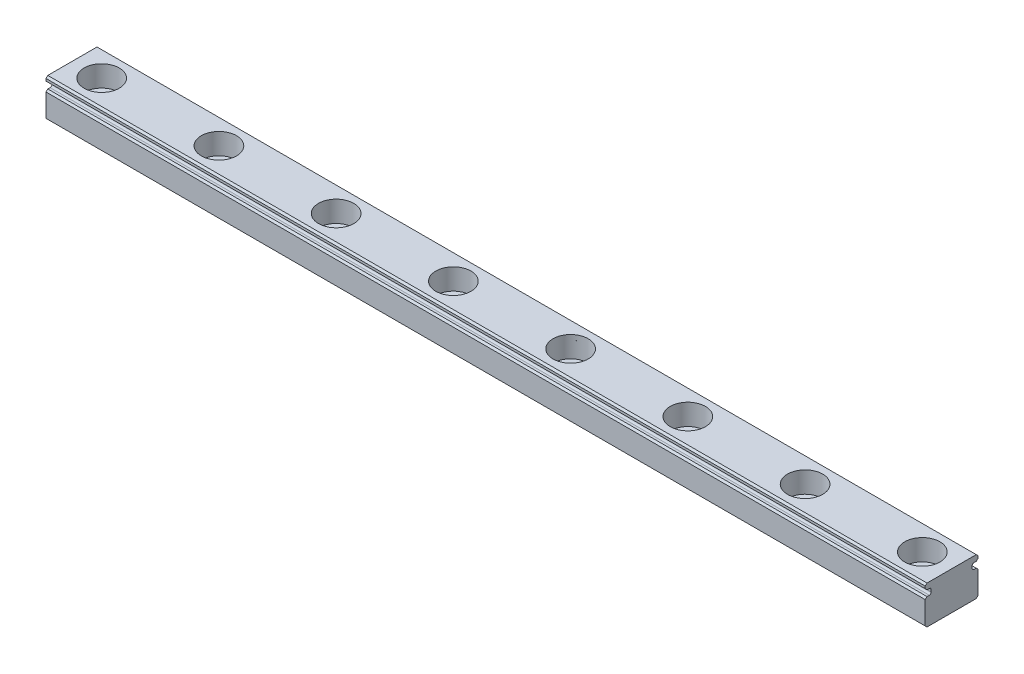
from build123d import *

# Parameters (mm, degrees)
SKETCH1_W           = 150
SKETCH1_H           = 9
BOSS_EXTRUDE1_DEPTH = 6.5
SKETCH2_W           = 1
SKETCH2_H           = 1
CUT_EXTRUDE1_DEPTH  = 156.5
SKETCH3_R           = 1.8
CUT_EXTRUDE2_DEPTH  = 9.5
SKETCH4_R           = 3
CUT_EXTRUDE3_DEPTH  = 3.6
FILLET1_R           = 0.3
CHAMFER1_SIZE       = 0.3


with BuildPart() as part:
    # Sketch1 → Boss-Extrude1 (new body)
    with BuildSketch(Plane(origin=(0, 0, 0), x_dir=(1, 0, 0), z_dir=(0, 1, 0))):
        with Locations((75, 4.5)):
            Rectangle(SKETCH1_W, SKETCH1_H)
    extrude(amount=BOSS_EXTRUDE1_DEPTH)

    # Sketch2 → Cut-Extrude1 (cut)
    with BuildSketch(Plane(origin=(150, 0, 0), x_dir=(0, 0, -1), z_dir=(1, 0, 0))):
        with Locations((0.5, 5)):
            Rectangle(SKETCH2_W, SKETCH2_H)
        with Locations((8.5, 5)):
            Rectangle(SKETCH2_W, SKETCH2_H)
    extrude(amount=-CUT_EXTRUDE1_DEPTH, mode=Mode.SUBTRACT)

    # Sketch3 → Cut-Extrude2 (cut)
    with BuildSketch(Plane(origin=(0, 6.5, 0), x_dir=(1, 0, 0), z_dir=(0, 1, 0))):
        with Locations(Location((5, 4.5, 0), (0, 0, 270))):
            Circle(SKETCH3_R)
        with Locations(Location((25, 4.5, 0), (0, 0, 270))):
            Circle(SKETCH3_R)
        with Locations(Location((45, 4.5, 0), (0, 0, 270))):
            Circle(SKETCH3_R)
        with Locations(Location((65, 4.5, 0), (0, 0, 270))):
            Circle(SKETCH3_R)
        with Locations(Location((85, 4.5, 0), (0, 0, 270))):
            Circle(SKETCH3_R)
        with Locations(Location((105, 4.5, 0), (0, 0, 270))):
            Circle(SKETCH3_R)
        with Locations(Location((125, 4.5, 0), (0, 0, 270))):
            Circle(SKETCH3_R)
        with Locations(Location((145, 4.5, 0), (0, 0, 270))):
            Circle(SKETCH3_R)
    extrude(amount=-CUT_EXTRUDE2_DEPTH, mode=Mode.SUBTRACT)

    # Sketch4 → Cut-Extrude3 (cut)
    with BuildSketch(Plane(origin=(0, 6.5, 0), x_dir=(1, 0, 0), z_dir=(0, 1, 0))):
        with Locations(Location((5, 4.5, 0), (0, 0, 270))):
            Circle(SKETCH4_R)
        with Locations(Location((25, 4.5, 0), (0, 0, 270))):
            Circle(SKETCH4_R)
        with Locations(Location((45, 4.5, 0), (0, 0, 270))):
            Circle(SKETCH4_R)
        with Locations(Location((65, 4.5, 0), (0, 0, 270))):
            Circle(SKETCH4_R)
        with Locations(Location((85, 4.5, 0), (0, 0, 270))):
            Circle(SKETCH4_R)
        with Locations(Location((105, 4.5, 0), (0, 0, 270))):
            Circle(SKETCH4_R)
        with Locations(Location((125, 4.5, 0), (0, 0, 270))):
            Circle(SKETCH4_R)
        with Locations(Location((145, 4.5, 0), (0, 0, 270))):
            Circle(SKETCH4_R)
    extrude(amount=-CUT_EXTRUDE3_DEPTH, mode=Mode.SUBTRACT)

    # Fillet1
    fillet1_edges = [part.edges().sort_by_distance(p)[0] for p in [
        (75, 5.5, -1),
        (75, 4.5, -1),
        (75, 4.5, -8),
        (75, 5.5, -8),
    ]]
    fillet(fillet1_edges, radius=FILLET1_R)

    # Chamfer1
    chamfer1_edges = [part.edges().sort_by_distance(p)[0] for p in [
        (75, 5.5, -9),
        (75, 4.5, -9),
        (75, 6.5, -9),
        (75, 4.5, 0),
        (75, 5.5, 0),
        (75, 0, -9),
        (75, 0, 0),
        (75, 6.5, 0),
    ]]
    chamfer(chamfer1_edges, length=CHAMFER1_SIZE)


solid = part.part
